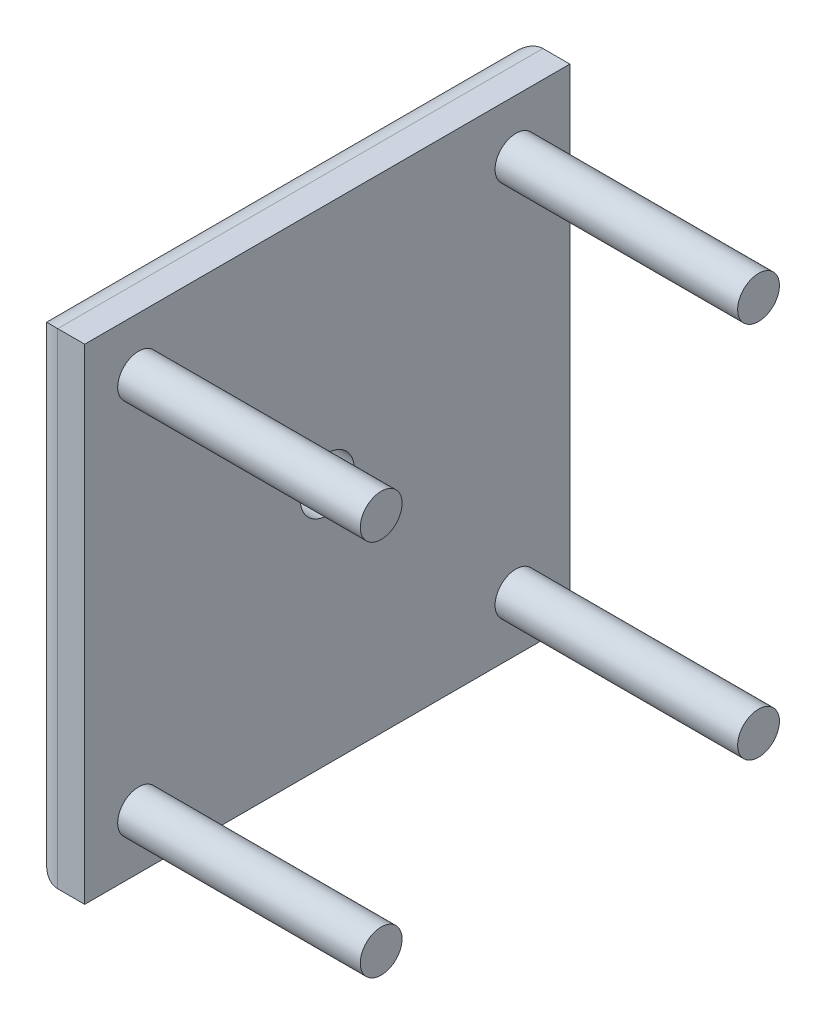
from build123d import *

# Parameters (mm, degrees)
SKETCH1_W           = 18
SKETCH1_H           = 18
SKETCH1_R           = 0.75
BOSS_EXTRUDE1_DEPTH = 2
SKETCH2_R           = 0.775
BOSS_EXTRUDE2_DEPTH = 9
SKETCH3_R           = 1
CUT_EXTRUDE1_DEPTH  = 9
FILLET2_R           = 1


with BuildPart() as part:
    # Sketch1 → Boss-Extrude1 (new body)
    # profile 1 of 5: a face of its own
    with BuildSketch(Plane(origin=(0, 0, 0), x_dir=(0, 0, -1), z_dir=(1, 0, 0))):
        Rectangle(SKETCH1_W, SKETCH1_H)
        with Locations((-7, -7)):
            Circle(SKETCH1_R, mode=Mode.SUBTRACT)
        with Locations((7, -7)):
            Circle(SKETCH1_R, mode=Mode.SUBTRACT)
        with Locations((7, 7)):
            Circle(SKETCH1_R, mode=Mode.SUBTRACT)
        with Locations((-7, 7)):
            Circle(SKETCH1_R, mode=Mode.SUBTRACT)
    # profile 2 of 5: a face of its own
    with BuildSketch(Plane(origin=(0, 0, 0), x_dir=(0, 0, -1), z_dir=(1, 0, 0))):
        with Locations((7, 7)):
            Circle(SKETCH1_R)
    # profile 3 of 5: a face of its own
    with BuildSketch(Plane(origin=(0, 0, 0), x_dir=(0, 0, -1), z_dir=(1, 0, 0))):
        with Locations((-7, 7)):
            Circle(SKETCH1_R)
    # profile 4 of 5: a face of its own
    with BuildSketch(Plane(origin=(0, 0, 0), x_dir=(0, 0, -1), z_dir=(1, 0, 0))):
        with Locations((-7, -7)):
            Circle(SKETCH1_R)
    # profile 5 of 5: a face of its own
    with BuildSketch(Plane(origin=(0, 0, 0), x_dir=(0, 0, -1), z_dir=(1, 0, 0))):
        with Locations((7, -7)):
            Circle(SKETCH1_R)
    extrude(amount=BOSS_EXTRUDE1_DEPTH)

    # Sketch2 → Boss-Extrude2 (add)
    with BuildSketch(Plane(origin=(2, 0, 0), x_dir=(0, 0, -1), z_dir=(1, 0, 0))):
        with Locations((-7, 7)):
            Circle(SKETCH2_R)
        with Locations((-7, -7)):
            Circle(SKETCH2_R)
        with Locations((7, -7)):
            Circle(SKETCH2_R)
        with Locations((7, 7)):
            Circle(SKETCH2_R)
    extrude(amount=BOSS_EXTRUDE2_DEPTH)

    # Sketch3 → Cut-Extrude1 (cut)
    with BuildSketch(Plane.ZY):
        Circle(SKETCH3_R)
    extrude(amount=-CUT_EXTRUDE1_DEPTH, mode=Mode.SUBTRACT)

    # Fillet2
    fillet2_edges = [part.edges().sort_by_distance(p)[0] for p in [
        (0, 0, 9),
        (0, 9, 0),
        (0, 0, -9),
        (0, -9, 0),
    ]]
    fillet(fillet2_edges, radius=FILLET2_R)


solid = part.part
